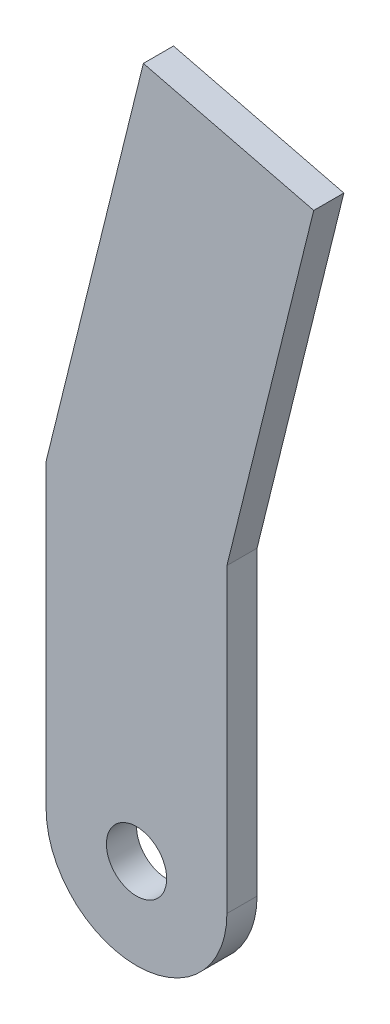
from build123d import *

# Parameters (mm, degrees)
SKETCH1_R           = 5
BOSS_EXTRUDE1_DEPTH = 5


with BuildPart() as part:
    # Sketch1 → Boss-Extrude1 (new body)
    with BuildSketch(Plane.XY):
        with BuildLine():
            Line((-15, 50), (1.134004543, 115.236947355))
            Line((1.134004543, 115.236947355), (29.404842216, 108.245175944))
            Line((29.404842216, 108.245175944), (15, 50))
            Line((15, 50), (15, 0))
            ThreePointArc((15, 0), (0, -15), (-15, 0))
            Line((-15, 0), (-15, 50))
        make_face()
        Circle(SKETCH1_R, mode=Mode.SUBTRACT)
    extrude(amount=BOSS_EXTRUDE1_DEPTH)


solid = part.part
